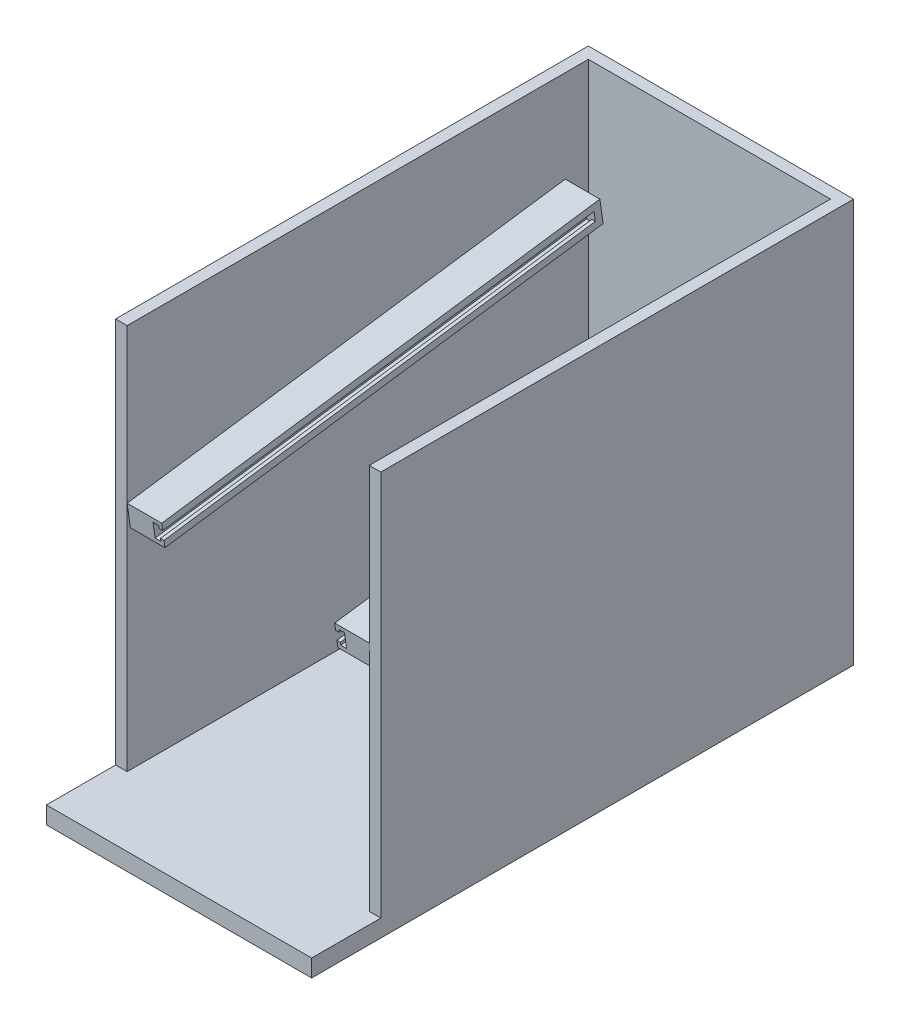
from build123d import *

# Parameters (mm, degrees)
SKETCH1_W           = 292.1
SKETCH1_H           = 596.9
BOSS_EXTRUDE1_DEPTH = 19.05
BOSS_EXTRUDE2_DEPTH = 425.45
BOSS_EXTRUDE3_DEPTH = 38.1
CUT_EXTRUDE1_DEPTH  = 10.16
CUT_EXTRUDE2_START  = -3.175
SKETCH5_W           = 6.35
SKETCH5_H           = 479.722786497
CUT_EXTRUDE2_DEPTH  = 16.51
SKETCH6_W           = 25.4
SKETCH6_H           = 177.8
BOSS_EXTRUDE4_DEPTH = 241.3
BOSS_EXTRUDE6_DEPTH = 38.1
CUT_EXTRUDE3_DEPTH  = 3.81


with BuildPart() as part:
    # Sketch1 → Boss-Extrude1 (new body)
    with BuildSketch(Plane(origin=(0, 0, 0), x_dir=(1, 0, 0), z_dir=(0, 1, 0))):
        Rectangle(SKETCH1_W, SKETCH1_H)
    extrude(amount=BOSS_EXTRUDE1_DEPTH)

    # Sketch2 → Boss-Extrude2 (add)
    with BuildSketch(Plane(origin=(0, 19.05, 0), x_dir=(1, 0, 0), z_dir=(0, 1, 0))):
        Polygon((-146.05, -222.25), (-146.05, 298.45), (146.05, 298.45), (146.05, -222.25), (133.35, -222.25), (133.35, 285.75), (-133.35, 285.75), (-133.35, -222.25), align=None)
    extrude(amount=BOSS_EXTRUDE2_DEPTH)

    # Sketch3 → Boss-Extrude3 (add)
    with BuildSketch(Plane(origin=(-133.35, 0, 0), x_dir=(0, 0, -1), z_dir=(1, 0, 0))):
        Polygon((-222.25, 275.074993173), (260.35, 342.9), (263.884996764, 317.747191054), (-218.715003236, 249.922184227), align=None)
    boss_extrude3 = extrude(amount=BOSS_EXTRUDE3_DEPTH)

    # Sketch4 → Cut-Extrude1 (cut)
    with BuildSketch(Plane(origin=(-95.25, 0, 0), x_dir=(0, 0, -1), z_dir=(1, 0, 0))):
        Polygon((-221.196449058, 267.5785887), (-219.768554178, 257.4185887), (255.285603139, 324.183096498), (253.857708258, 334.343096498), align=None)
    cut_extrude1 = extrude(amount=-CUT_EXTRUDE1_DEPTH, mode=Mode.SUBTRACT)

    # Sketch5 → Cut-Extrude2 (cut)
    with BuildSketch(Plane(origin=(0, 292.880820502, 41.161714982), x_dir=(1, 0, 0), z_dir=(0, -0.9902680687415715, -0.13917310096005858)).offset(CUT_EXTRUDE2_START)):
        with Locations((-102.235, -58.057354767)):
            Rectangle(SKETCH5_W, SKETCH5_H)
    cut_extrude2 = extrude(amount=CUT_EXTRUDE2_DEPTH, mode=Mode.SUBTRACT)

    # Mirror1: Boss-Extrude3, Cut-Extrude1, Cut-Extrude2 across plane
    add(boss_extrude3.mirror(Plane(origin=(0, 0, 0), x_dir=(0, 0, 1), z_dir=(1, 0, 0))))
    add(cut_extrude1.mirror(Plane(origin=(0, 0, 0), x_dir=(0, 0, 1), z_dir=(1, 0, 0))), mode=Mode.SUBTRACT)
    add(cut_extrude2.mirror(Plane(origin=(0, 0, 0), x_dir=(0, 0, 1), z_dir=(1, 0, 0))), mode=Mode.SUBTRACT)

    # Sketch6 → Boss-Extrude4 (add)
    with BuildSketch(Plane(origin=(0, 19.05, 0), x_dir=(1, 0, 0), z_dir=(0, 1, 0))):
        with Locations((0, 196.85)):
            Rectangle(SKETCH6_W, SKETCH6_H)
    extrude(amount=BOSS_EXTRUDE4_DEPTH)

    # Sketch8 → Boss-Extrude6 (add)
    with BuildSketch(Plane.XY.offset(-285.75)):
        with BuildLine():
            Line((-123.19, 19.05), (-41.91, 19.05))
            ThreePointArc((-41.91, 19.05), (-34.725795103, 22.025795103), (-31.75, 29.21))
            Line((-31.75, 29.21), (-31.75, 148.59))
            ThreePointArc((-31.75, 148.59), (-34.725795103, 155.774204897), (-41.91, 158.75))
            Line((-41.91, 158.75), (-123.19, 158.75))
            ThreePointArc((-123.19, 158.75), (-130.374204897, 155.774204897), (-133.35, 148.59))
            Line((-133.35, 148.59), (-133.35, 29.21))
            ThreePointArc((-133.35, 29.21), (-130.374204897, 22.025795103), (-123.19, 19.05))
        make_face()
    extrude(amount=BOSS_EXTRUDE6_DEPTH)

    # Sketch9 → Cut-Extrude3 (cut)
    with BuildSketch(Plane.XY.offset(-247.65)):
        with BuildLine():
            Line((-118.11, 139.7), (-46.99, 139.7))
            ThreePointArc((-46.99, 139.7), (-45.193948776, 138.956051224), (-44.45, 137.16))
            Line((-44.45, 137.16), (-44.45, 66.04))
            ThreePointArc((-44.45, 66.04), (-45.193948776, 64.243948776), (-46.99, 63.5))
            Line((-46.99, 63.5), (-118.11, 63.5))
            ThreePointArc((-118.11, 63.5), (-119.906051224, 64.243948776), (-120.65, 66.04))
            Line((-120.65, 66.04), (-120.65, 137.16))
            ThreePointArc((-120.65, 137.16), (-119.906051224, 138.956051224), (-118.11, 139.7))
        make_face()
    extrude(amount=-CUT_EXTRUDE3_DEPTH, mode=Mode.SUBTRACT)


solid = part.part
